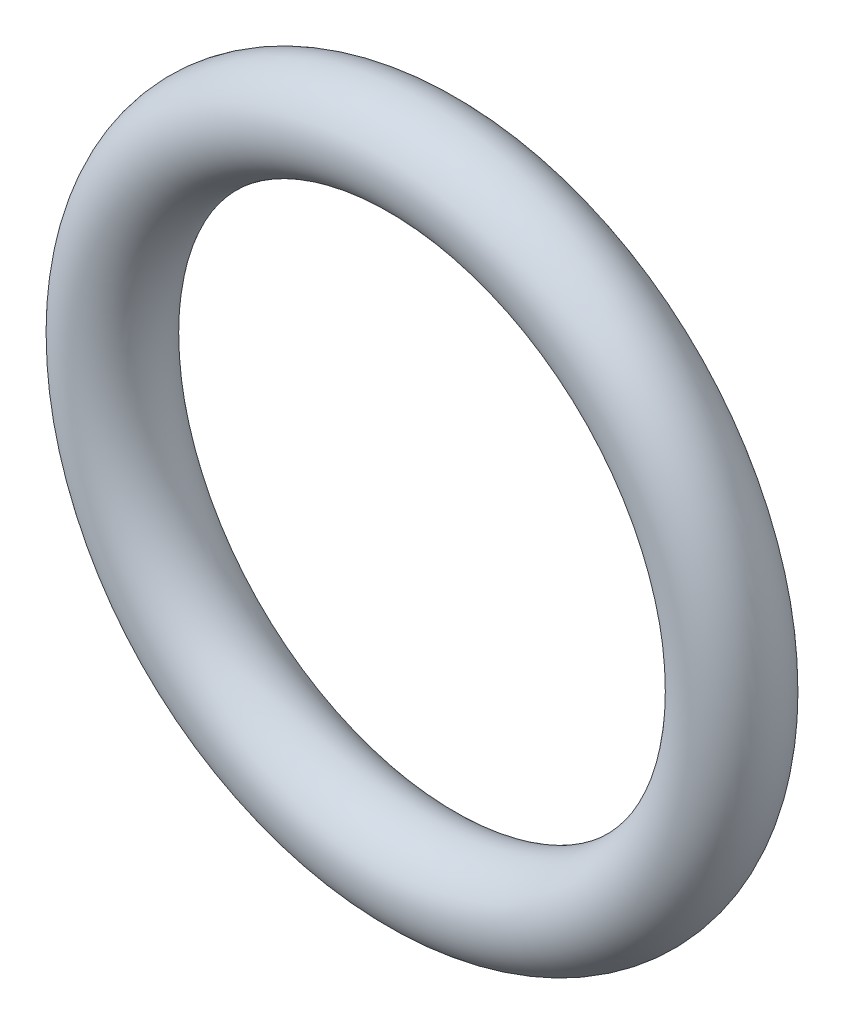
from build123d import *

# Parameters (mm, degrees)
SKETCH1_R = 1.25


with BuildPart() as part:
    # Sketch1 → Revolve1 (revolve)
    with BuildSketch(Plane(origin=(0, 0, 0), x_dir=(0, 0, -1), z_dir=(1, 0, 0)), mode=Mode.PRIVATE) as revolve1_sk:
        with Locations((0, 8.25)):
            Circle(SKETCH1_R)
    revolve(revolve1_sk.sketch.rotate(Axis((0, 0, 0), (0, 0, -1)), 90), axis=Axis((0, 0, 0), (0, 0, -1)))


solid = part.part
